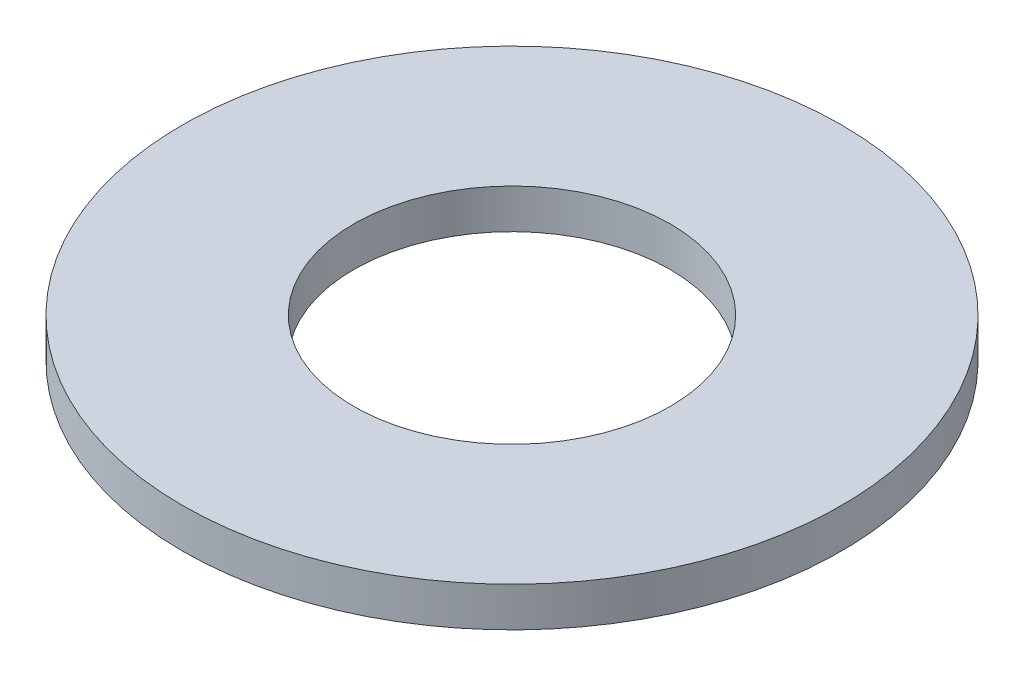
from build123d import *

# Parameters (mm, degrees)
SKETCH_1_W = 1.3
SKETCH_1_H = 0.3


with BuildPart() as part:
    # 草图1 → Revolve 469 (revolve)
    with BuildSketch(Plane.XY, mode=Mode.PRIVATE) as revolve_469_sk:
        with Locations((-1.85, 8.794507042)):
            Rectangle(SKETCH_1_W, SKETCH_1_H)
    revolve(revolve_469_sk.sketch.rotate(Axis((0, 0, 0), (0, 1, 0)), 270), axis=Axis((0, 0, 0), (0, 1, 0)))


solid = part.part
